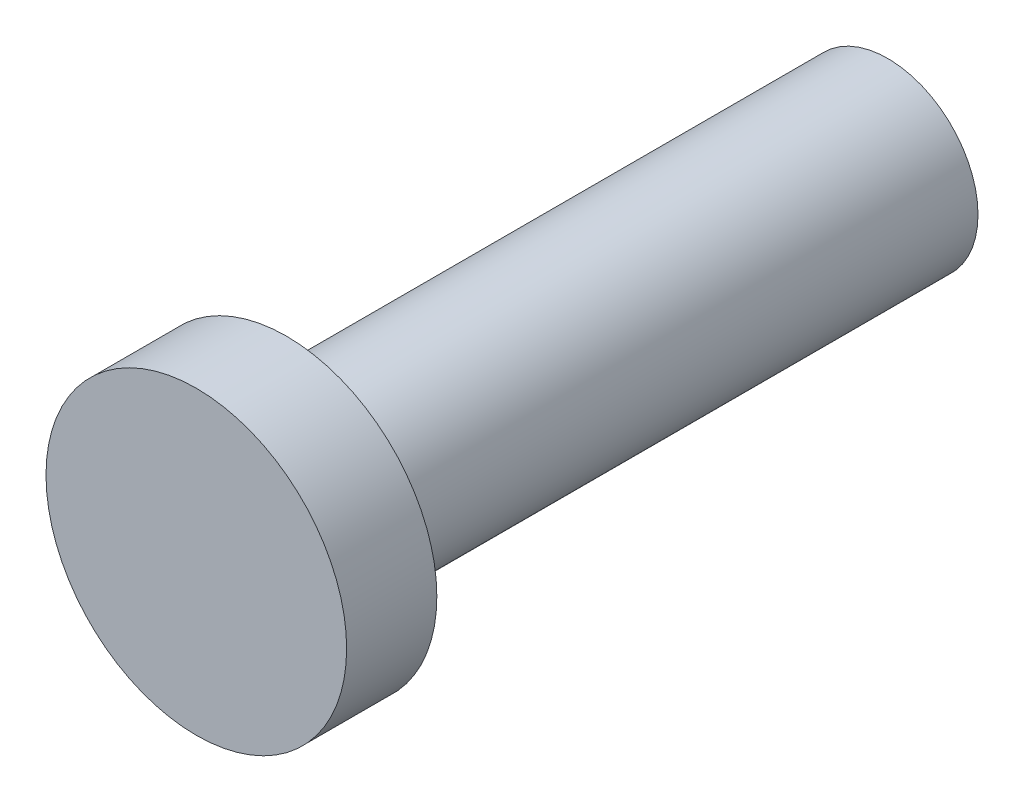
from build123d import *

# Parameters (mm, degrees)
CROQUIS1_R              = 2.5
SALIENTE_EXTRUIR1_DEPTH = 1.5
CROQUIS1_3_R            = 1.5
SALIENTE_EXTRUIR2_DEPTH = 10


with BuildPart() as part:
    # Croquis1 → Saliente-Extruir1 (new body)
    with BuildSketch(Plane.XY):
        Circle(CROQUIS1_R)
    extrude(amount=SALIENTE_EXTRUIR1_DEPTH)

    # Croquis1<3> → Saliente-Extruir2 (add)
    with BuildSketch(Plane.XY):
        Circle(CROQUIS1_3_R)
    extrude(amount=-SALIENTE_EXTRUIR2_DEPTH)


solid = part.part
